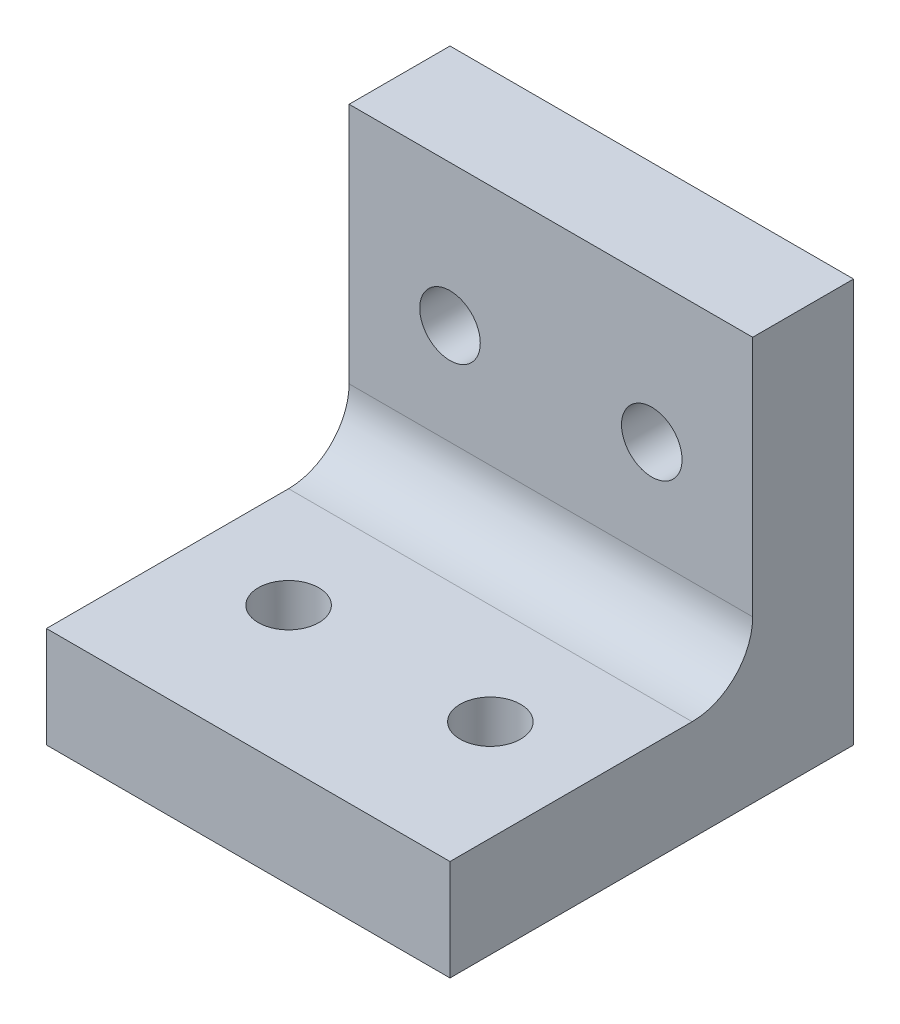
from build123d import *

# Parameters (mm, degrees)
SKETCH1_W               = 20
SKETCH1_H               = 20
BOSS_EXTRUDE1_DEPTH     = 5
SKETCH2_W               = 20
SKETCH2_H               = 5
BOSS_EXTRUDE2_DEPTH     = 15
CUT_EXTRUDE1_DEPTH      = 21.615528128
CUT_EXTRUDE1_DEPTH_BACK = 21.615528128
SKETCH3_R               = 1.5
CUT_EXTRUDE2_DEPTH      = 27.925824036
CUT_EXTRUDE2_DEPTH_BACK = 27.925824036
SKETCH4_R               = 1.5
FILLET1_R               = 3


with BuildPart() as part:
    # Sketch1 → Boss-Extrude1 (new body)
    with BuildSketch(Plane(origin=(0, 0, 0), x_dir=(1, 0, 0), z_dir=(0, 1, 0))):
        Rectangle(SKETCH1_W, SKETCH1_H)
    extrude(amount=BOSS_EXTRUDE1_DEPTH)

    # Sketch2 → Boss-Extrude2 (add)
    with BuildSketch(Plane(origin=(0, 5, 0), x_dir=(1, 0, 0), z_dir=(0, 1, 0))):
        with Locations((0, 7.5)):
            Rectangle(SKETCH2_W, SKETCH2_H)
    extrude(amount=BOSS_EXTRUDE2_DEPTH)

    # Sketch3 → Cut-Extrude1 (cut, two sides: drawn at the far end of the back side and taken through both)
    with BuildSketch(Plane(origin=(0, 5, 0), x_dir=(1, 0, 0), z_dir=(0, 1, 0)).offset(-CUT_EXTRUDE1_DEPTH_BACK)):
        with Locations(Location((-5, -3, 0), (0, 0, 270))):
            Circle(SKETCH3_R)
        with Locations(Location((5, -3, 0), (0, 0, 90))):
            Circle(SKETCH3_R)
    extrude(amount=CUT_EXTRUDE1_DEPTH + CUT_EXTRUDE1_DEPTH_BACK, mode=Mode.SUBTRACT)

    # Sketch4 → Cut-Extrude2 (cut, two sides: drawn at the far end of the back side and taken through both)
    with BuildSketch(Plane.XY.offset(-5).offset(-CUT_EXTRUDE2_DEPTH_BACK)):
        with Locations((-5, 13)):
            Circle(SKETCH4_R)
        with Locations(Location((5, 13, 0), (0, 0, 180))):
            Circle(SKETCH4_R)
    extrude(amount=CUT_EXTRUDE2_DEPTH + CUT_EXTRUDE2_DEPTH_BACK, mode=Mode.SUBTRACT)

    # Fillet1
    fillet1_edges = [part.edges().sort_by_distance(p)[0] for p in [
        (0, 5, -5),
    ]]
    fillet(fillet1_edges, radius=FILLET1_R)


solid = part.part
